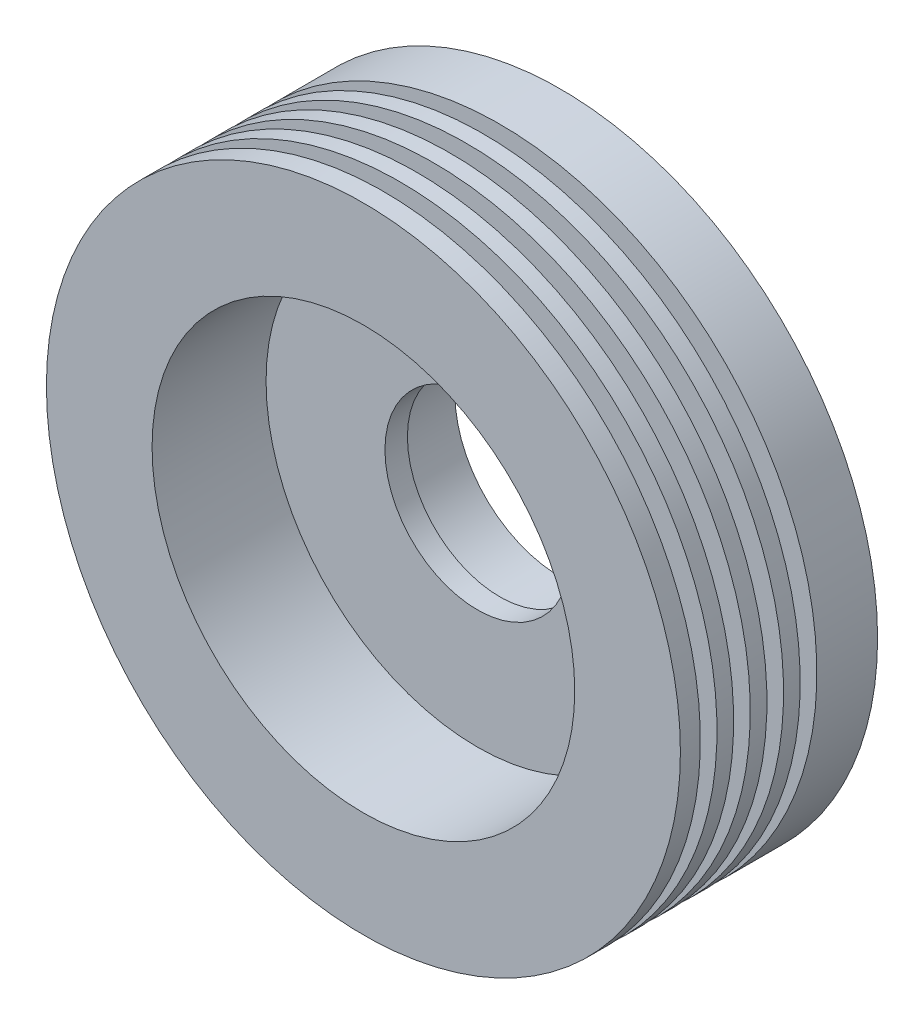
from build123d import *

# Parameters (mm, degrees)
ESQUISSE1_R                = 38.1
BOSS_EXTRU_1_DEPTH         = 23.7
ESQUISSE2_R                = 12.7
ENL_V_MAT_EXTRU_1_DEPTH    = 7.3
ESQUISSE3_R                = 11.1125
ENL_V_MAT_EXTRU_2_DEPTH    = 2.7
ESQUISSE4_R                = 25.4
ENL_V_MAT_EXTRU_3_DEPTH    = 56.59595309
ESQUISSE6_OUTSIDE_W        = 100.268
ESQUISSE6_OUTSIDE_H        = 100.268
ESQUISSE6_OUTSIDE_R        = 34.925
ENL_V_MAT_EXTRU_4_DEPTH    = 2
R_P_TITION_LIN_AIRE1_COUNT = 4
R_P_TITION_LIN_AIRE1_PITCH = 4


with BuildPart() as part:
    # Esquisse1 → Boss.-Extru.1 (new body)
    with BuildSketch(Plane.XY):
        Circle(ESQUISSE1_R)
    extrude(amount=BOSS_EXTRU_1_DEPTH)

    # Esquisse2 → Enlèv. mat.-Extru.1 (cut)
    with BuildSketch(Plane(origin=(0, 0, 0), x_dir=(-1, 0, 0), z_dir=(0, 0, -1))):
        Circle(ESQUISSE2_R)
    extrude(amount=-ENL_V_MAT_EXTRU_1_DEPTH, mode=Mode.SUBTRACT)

    # Esquisse3 → Enlèv. mat.-Extru.2 (cut)
    with BuildSketch(Plane(origin=(0, 0, 7.3), x_dir=(-1, 0, 0), z_dir=(0, 0, -1))):
        Circle(ESQUISSE3_R)
    extrude(amount=-ENL_V_MAT_EXTRU_2_DEPTH, mode=Mode.SUBTRACT)

    # Esquisse4 → Enlèv. mat.-Extru.3 (cut, through all)
    with BuildSketch(Plane(origin=(0, 0, 10), x_dir=(-1, 0, 0), z_dir=(0, 0, -1))):
        Circle(ESQUISSE4_R)
    extrude(amount=-ENL_V_MAT_EXTRU_3_DEPTH, mode=Mode.SUBTRACT)

    # Esquisse6 outside → Enlèv. mat.-Extru.4 (cut)
    with BuildSketch(Plane(origin=(0, 0, 7.3), x_dir=(-1, 0, 0), z_dir=(0, 0, -1))):
        Rectangle(ESQUISSE6_OUTSIDE_W, ESQUISSE6_OUTSIDE_H)
        Circle(ESQUISSE6_OUTSIDE_R, mode=Mode.SUBTRACT)
    enl_v_mat_extru_4 = extrude(amount=-ENL_V_MAT_EXTRU_4_DEPTH, mode=Mode.SUBTRACT)

    # Répétition linéaire1: Enlèv. mat.-Extru.4 ×4
    with Locations(*[(0, 0, i * R_P_TITION_LIN_AIRE1_PITCH) for i in range(1, R_P_TITION_LIN_AIRE1_COUNT)]):
        add(enl_v_mat_extru_4, mode=Mode.SUBTRACT)


solid = part.part
